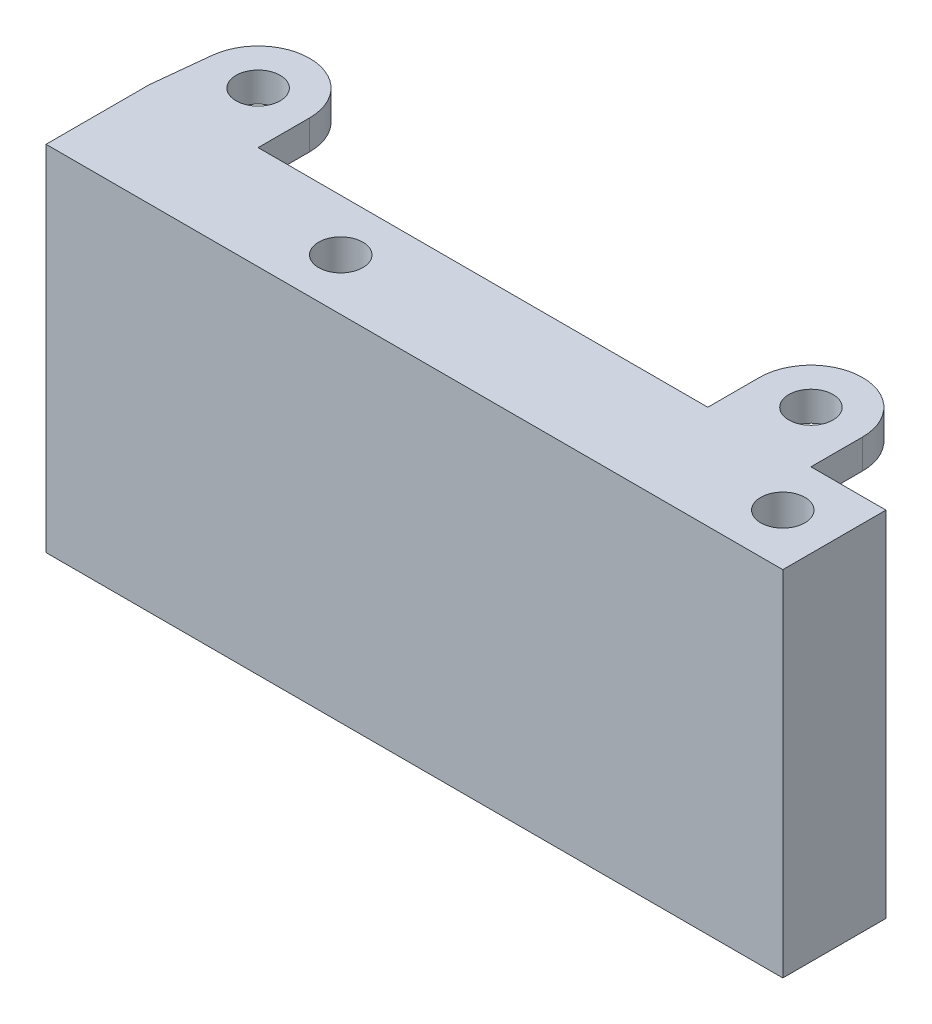
from build123d import *

# Parameters (mm, degrees)
SKETCH2_W           = 50
SKETCH2_H           = 24
BOSS_EXTRUDE1_DEPTH = 7
SKETCH3_R           = 1.5
BOSS_EXTRUDE2_DEPTH = 2
BOSS_EXTRUDE3_START = -22
SKETCH3_2_R         = 1.5
BOSS_EXTRUDE3_DEPTH = 2
SKETCH5_R           = 1.5
CUT_EXTRUDE1_DEPTH  = 24
SKETCH6_R           = 1.5
CUT_EXTRUDE2_DEPTH  = 24


with BuildPart() as part:
    # Sketch2 → Boss-Extrude1 (new body)
    with BuildSketch(Plane.XY):
        with Locations((25, 12)):
            Rectangle(SKETCH2_W, SKETCH2_H)
    extrude(amount=BOSS_EXTRUDE1_DEPTH)

    # Sketch3 → Boss-Extrude2 (add)
    # profile 1 of 2: a face of its own
    with BuildSketch(Plane.XZ):
        with BuildLine():
            Line((7.39152842, -3.5), (7.39152842, 0))
            Line((7.39152842, 0), (0, 0))
            Line((0, 0), (0.411114128, -3.869751751))
            ThreePointArc((0.411114128, -3.869751751), (4.076663477, -6.995100143), (7.39152842, -3.5))
        make_face()
        with Locations(Location((3.89152842, -3.5, 0), (0, 0, 270))):
            Circle(SKETCH3_R, mode=Mode.SUBTRACT)
    # profile 2 of 2: a face of its own
    with BuildSketch(Plane.XZ):
        with BuildLine():
            Line((44.910130544, -3.5), (44.910130544, 0))
            Line((44.910130544, 0), (37.910130544, 0))
            Line((37.910130544, 0), (37.910130544, -3.5))
            ThreePointArc((37.910130544, -3.5), (41.410130544, -7), (44.910130544, -3.5))
        make_face()
        with Locations(Location((41.410130544, -3.5, 0), (0, 0, 270))):
            Circle(SKETCH3_R, mode=Mode.SUBTRACT)
    extrude(amount=-BOSS_EXTRUDE2_DEPTH)

    # Sketch3<2> → Boss-Extrude3 (add)
    # profile 1 of 2: a face of its own
    with BuildSketch(Plane.XZ.offset(BOSS_EXTRUDE3_START)):
        with BuildLine():
            Line((7.39152842, -3.5), (7.39152842, 0))
            Line((7.39152842, 0), (0, 0))
            Line((0, 0), (0.411114128, -3.869751751))
            ThreePointArc((0.411114128, -3.869751751), (4.076663477, -6.995100143), (7.39152842, -3.5))
        make_face()
        with Locations(Location((3.89152842, -3.5, 0), (0, 0, 270))):
            Circle(SKETCH3_2_R, mode=Mode.SUBTRACT)
    # profile 2 of 2: a face of its own
    with BuildSketch(Plane.XZ.offset(BOSS_EXTRUDE3_START)):
        with BuildLine():
            Line((44.910130544, -3.5), (44.910130544, 0))
            Line((44.910130544, 0), (37.910130544, 0))
            Line((37.910130544, 0), (37.910130544, -3.5))
            ThreePointArc((37.910130544, -3.5), (41.410130544, -7), (44.910130544, -3.5))
        make_face()
        with Locations(Location((41.410130544, -3.5, 0), (0, 0, 270))):
            Circle(SKETCH3_2_R, mode=Mode.SUBTRACT)
    extrude(amount=-BOSS_EXTRUDE3_DEPTH)

    # Sketch5 → Cut-Extrude1 (cut)
    with BuildSketch(Plane.XZ):
        with Locations(Location((46.5, 3.5, 0), (0, 0, 270))):
            Circle(SKETCH5_R)
    extrude(amount=-CUT_EXTRUDE1_DEPTH, mode=Mode.SUBTRACT)

    # Sketch6 → Cut-Extrude2 (cut)
    with BuildSketch(Plane.XZ):
        with Locations(Location((16.5, 3.5, 0), (0, 0, 270))):
            Circle(SKETCH6_R)
    extrude(amount=-CUT_EXTRUDE2_DEPTH, mode=Mode.SUBTRACT)


solid = part.part
